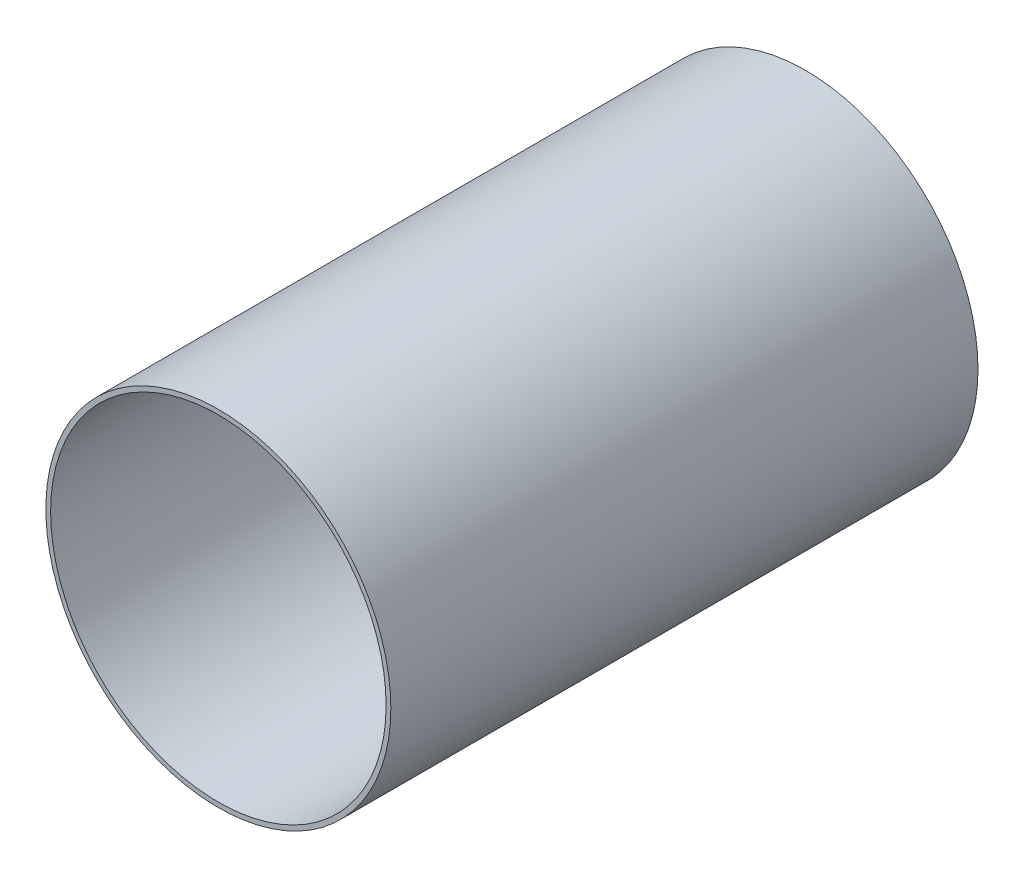
from build123d import *

# Parameters (mm, degrees)
ESQUISSE2_R        = 78.359
ESQUISSE2_R_2      = 76.2
BOSS_EXTRU_1_DEPTH = 266.7


with BuildPart() as part:
    # Esquisse2 → Boss.-Extru.1 (new body)
    with BuildSketch(Plane.XY):
        Circle(ESQUISSE2_R)
        Circle(ESQUISSE2_R_2, mode=Mode.SUBTRACT)
    extrude(amount=BOSS_EXTRU_1_DEPTH)


solid = part.part
